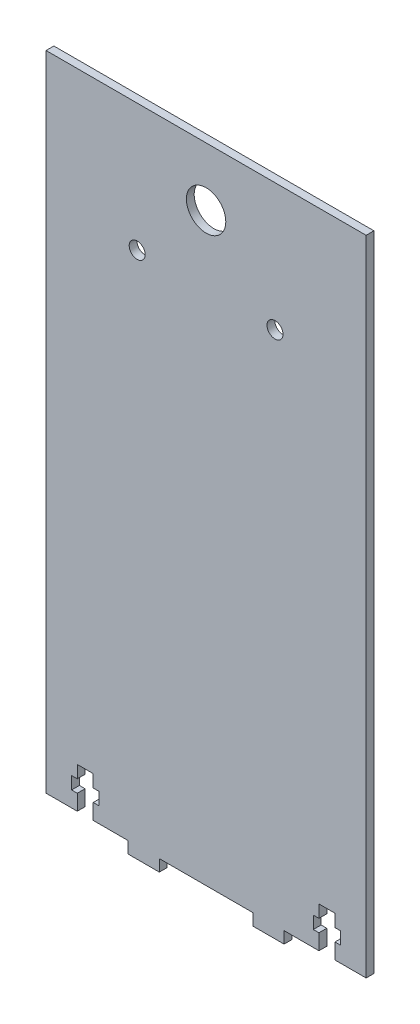
from build123d import *

# Parameters (mm, degrees)
SKETCH_1_R      = 5.05
SKETCH_1_R_2    = 2.05
EXTRUDE_1_DEPTH = 2


with BuildPart() as part:
    # 草图1 → 凸台-拉伸1 (new body)
    with BuildSketch(Plane.XY):
        Polygon((-28.741188564, 3.13029316), (-28.741188564, 7.13029316), (-27.291188564, 7.13029316), (-27.291188564, 10.33029316), (-28.741188564, 10.33029316), (-28.741188564, 13.53029316), (-32.841188564, 13.53029316), (-32.841188564, 10.33029316), (-34.291188564, 10.33029316), (-34.291188564, 7.13029316), (-32.841188564, 7.13029316), (-32.841188564, 3.13029316), (-40.841188564, 3.13029316), (-40.841188564, 168.13029316), (41.258811436, 168.13029316), (41.258811436, 3.13029316), (33.258811436, 3.13029316), (33.258811436, 7.13029316), (34.708811436, 7.13029316), (34.708811436, 10.33029316), (33.258811436, 10.33029316), (33.258811436, 13.53029316), (29.158811436, 13.53029316), (29.158811436, 10.33029316), (27.708811436, 10.33029316), (27.708811436, 7.13029316), (29.158811436, 7.13029316), (29.158811436, 3.13029316), (20.208811436, 3.13029316), (20.208811436, 0.13029316), (12.208811436, 0.13029316), (12.208811436, 3.13029316), (-11.791188564, 3.13029316), (-11.791188564, 0.13029316), (-19.791188564, 0.13029316), (-19.791188564, 3.13029316), align=None)
        with Locations((0.208811436, 153.13029316)):
            Circle(SKETCH_1_R, mode=Mode.SUBTRACT)
        with Locations((17.886480965, 135.45262363)):
            Circle(SKETCH_1_R_2, mode=Mode.SUBTRACT)
        with Locations(Location((-17.468858094, 135.45262363, 0), (0, 0, 180))):
            Circle(SKETCH_1_R_2, mode=Mode.SUBTRACT)
    extrude(amount=EXTRUDE_1_DEPTH)


solid = part.part
